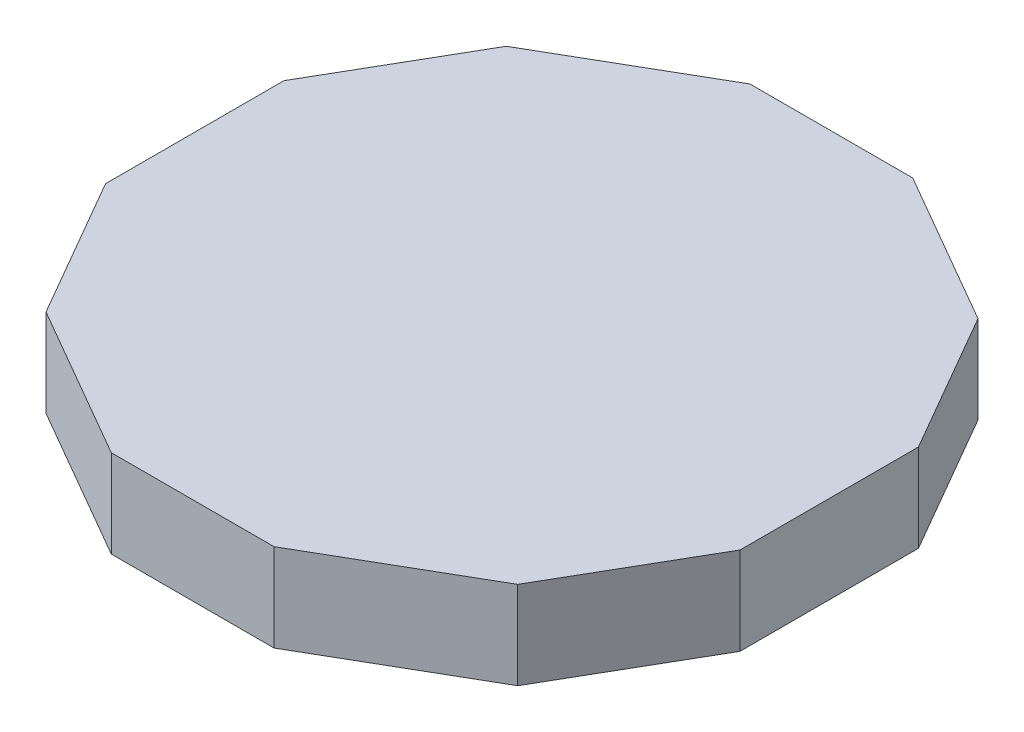
from build123d import *

# Parameters (mm, degrees)
EXTRUDE_1_DEPTH = 80


with BuildPart() as part:
    # 草图4 → 凸台-拉伸1 (new body)
    with BuildSketch(Plane(origin=(0, 0, 0), x_dir=(1, 0, 0), z_dir=(0, 1, 0))):
        Polygon((-289.088505698, 81.284020248), (-289.088505698, -81.284020248), (-214.938279305, -209.715979752), (-74.150226393, -291), (74.150226393, -291), (214.938279305, -209.715979752), (289.088505698, -81.284020248), (289.088505698, 81.284020248), (214.938279305, 209.715979752), (74.150226393, 291), (-74.150226393, 291), (-214.938279305, 209.715979752), align=None)
    extrude(amount=EXTRUDE_1_DEPTH)


solid = part.part
